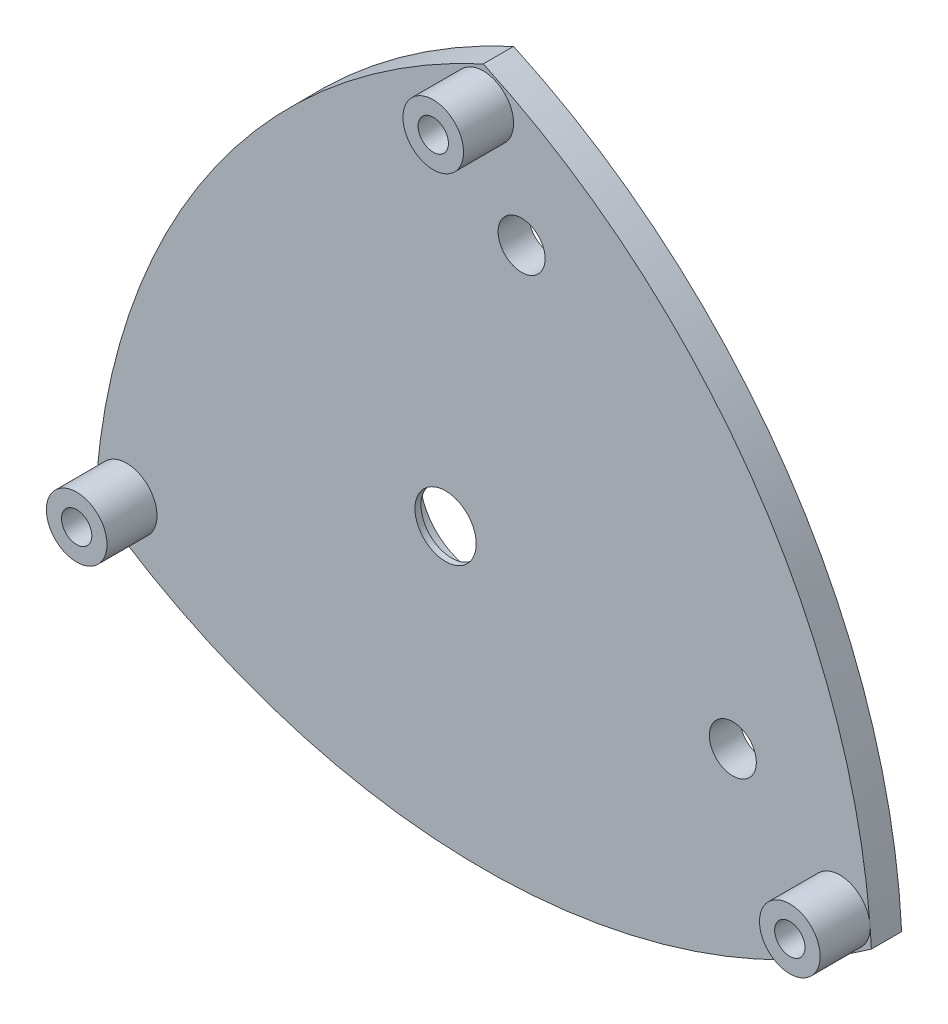
from build123d import *

# Parameters (mm, degrees)
SKETCH_1_R          = 5
EXTRUDE_1_DEPTH     = 10
SKETCH_2_R          = 10
SKETCH_2_R_2        = 5
EXTRUDE_2_DEPTH     = 16.5
SKETCH_3_R          = 7.75
SKETCH_3_R_2        = 15
CUT_EXTRUDE_1_DEPTH = 15
SKETCH_5_R          = 18.5
CUT_EXTRUDE_3_DEPTH = 10
EXTRUDE_START       = -2
SKETCH_6_R          = 18.5
EXTRUDE_3_DEPTH     = 2
SKETCH_7_R          = 10.1
CUT_EXTRUDE_4_DEPTH = 8


with BuildPart() as part:
    # 草图1 → 凸台-拉伸1 (new body)
    with BuildSketch(Plane.XY):
        with BuildLine():
            ThreePointArc((-128.022678922, -73.913928138), (-90.421378279, 38.440519474), (0, 115))
            ThreePointArc((0, 115), (90.421378279, 38.440519474), (128.022678922, -73.913928138))
            ThreePointArc((128.022678922, -73.913928138), (0, -115), (-128.022678922, -73.913928138))
        make_face()
        with Locations((0, 103)):
            Circle(SKETCH_1_R, mode=Mode.SUBTRACT)
        with Locations((-117.630374076, -67.913928138)):
            Circle(SKETCH_1_R, mode=Mode.SUBTRACT)
        with Locations((117.630374076, -67.913928138)):
            Circle(SKETCH_1_R, mode=Mode.SUBTRACT)
    extrude(amount=EXTRUDE_1_DEPTH)

    # 草图2 → 凸台-拉伸2 (add)
    # profile 1 of 3: a face of its own
    with BuildSketch(Plane.XY.offset(10)):
        with Locations((0, 103)):
            Circle(SKETCH_2_R)
        with Locations((0, 103)):
            Circle(SKETCH_2_R_2, mode=Mode.SUBTRACT)
    # profile 2 of 3: a face of its own
    with BuildSketch(Plane.XY.offset(10)):
        with Locations(Location((-117.630374076, -67.913928138, 0), (0, 0, 179.375778052))):
            Circle(SKETCH_2_R)
        with Locations((-117.630374076, -67.913928138)):
            Circle(SKETCH_2_R_2, mode=Mode.SUBTRACT)
    # profile 3 of 3: a face of its own
    with BuildSketch(Plane.XY.offset(10)):
        with Locations(Location((117.630374076, -67.913928138, 0), (0, 0, 8.696571879))):
            Circle(SKETCH_2_R)
        with Locations((117.630374076, -67.913928138)):
            Circle(SKETCH_2_R_2, mode=Mode.SUBTRACT)
    extrude(amount=EXTRUDE_2_DEPTH)

    # 草图3 → 切除-拉伸1 (cut)
    with BuildSketch(Plane(origin=(0, 0, 0), x_dir=(-1, 0, 0), z_dir=(0, 0, -1))):
        with Locations((-12.650995066, 69.515536741)):
            Circle(SKETCH_3_R)
        with Locations((-82.334125615, -39.530718783)):
            Circle(SKETCH_3_R)
        with Locations((12.428876199, -23.298802993)):
            Circle(SKETCH_3_R_2)
    extrude(amount=-CUT_EXTRUDE_1_DEPTH, mode=Mode.SUBTRACT)

    # 草图5 → 切除-拉伸3 (cut)
    with BuildSketch(Plane(origin=(0, 0, 0), x_dir=(-1, 0, 0), z_dir=(0, 0, -1))):
        with Locations((12.428876199, -23.298802993)):
            Circle(SKETCH_5_R)
    extrude(amount=-CUT_EXTRUDE_3_DEPTH, mode=Mode.SUBTRACT)

    # 草图6 → 凸台-拉伸3 (add)
    with BuildSketch(Plane.XY.offset(10).offset(EXTRUDE_START)):
        with Locations(Location((-12.428876199, -23.298802993, 0), (0, 0, 180))):
            Circle(SKETCH_6_R)
    extrude(amount=EXTRUDE_3_DEPTH)

    # 草图7 → 切除-拉伸4 (cut)
    with BuildSketch(Plane(origin=(0, 0, 8), x_dir=(-1, 0, 0), z_dir=(0, 0, -1))):
        with Locations((12.428876199, -23.298802993)):
            Circle(SKETCH_7_R)
    extrude(amount=-CUT_EXTRUDE_4_DEPTH, mode=Mode.SUBTRACT)


solid = part.part
